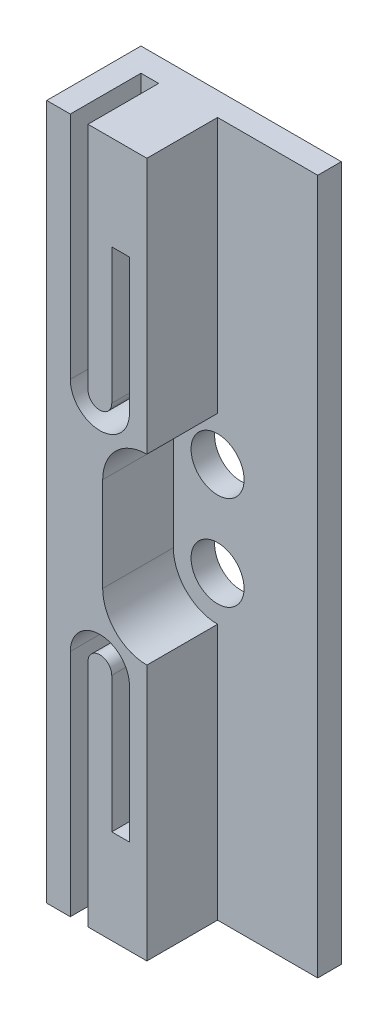
from build123d import *

# Parameters (mm, degrees)
ESQUISSE1_W             = 17
ESQUISSE1_H             = 59
BOSS_EXTRU_1_DEPTH      = 2
ESQUISSE2_W             = 8.5
ESQUISSE2_H             = 59
BOSS_EXTRU_2_DEPTH      = 6
ESQUISSE3_W             = 1.5
ESQUISSE3_H             = 19.5
ESQUISSE3_H_2           = 11.5
ENL_V_MAT_EXTRU_1_DEPTH = 6
ESQUISSE4_R             = 2.25
ENL_V_MAT_EXTRU_2_DEPTH = 14
ENL_V_MAT_EXTRU_3_DEPTH = 6


with BuildPart() as part:
    # Esquisse1 → Boss.-Extru.1 (new body)
    with BuildSketch(Plane.XY):
        with Locations((8.5, -29.5)):
            Rectangle(ESQUISSE1_W, ESQUISSE1_H)
    extrude(amount=BOSS_EXTRU_1_DEPTH)

    # Esquisse2 → Boss.-Extru.2 (add)
    with BuildSketch(Plane.XY.offset(2)):
        with Locations((4.25, -29.5)):
            Rectangle(ESQUISSE2_W, ESQUISSE2_H)
    extrude(amount=BOSS_EXTRU_2_DEPTH)

    # Esquisse3 → Enlèv. mat.-Extru.1 (cut)
    with BuildSketch(Plane.XY.offset(8)):
        with Locations((2.75, -49.25)):
            Rectangle(ESQUISSE3_W, ESQUISSE3_H)
        with BuildLine():
            ThreePointArc((3.5, -37.202199257), (2.408191843, -38.127967907), (2, -39.5))
            Line((2, -39.5), (3.5, -39.5))
            Line((3.5, -39.5), (3.5, -37.202199257))
        make_face()
        with BuildLine():
            Line((3.5, -37.202199257), (3.5, -39.5))
            ThreePointArc((3.5, -39.5), (4.509962751, -38.490037249), (5.519925502, -39.5))
            Line((5.519925502, -39.5), (5.519925502, -37.202199257))
            ThreePointArc((5.519925502, -37.202199257), (4.509962751, -36.990037249), (3.5, -37.202199257))
        make_face()
        with BuildLine():
            Line((5.519925502, -37.202199257), (5.519925502, -39.5))
            Line((5.519925502, -39.5), (7.019925502, -39.5))
            ThreePointArc((7.019925502, -39.5), (6.611733659, -38.127967907), (5.519925502, -37.202199257))
        make_face()
        with Locations((6.269925502, -45.25)):
            Rectangle(ESQUISSE3_W, ESQUISSE3_H_2)
        with Locations((6.269925502, -13.75)):
            Rectangle(ESQUISSE3_W, ESQUISSE3_H_2)
        with Locations((2.75, -9.75)):
            Rectangle(ESQUISSE3_W, ESQUISSE3_H)
        with BuildLine():
            Line((3.5, -19.5), (2, -19.5))
            ThreePointArc((2, -19.5), (2.408191843, -20.872032093), (3.5, -21.797800743))
            Line((3.5, -21.797800743), (3.5, -19.5))
        make_face()
        with BuildLine():
            ThreePointArc((5.519925502, -19.5), (4.509962751, -20.509962751), (3.5, -19.5))
            Line((3.5, -19.5), (3.5, -21.797800743))
            ThreePointArc((3.5, -21.797800743), (4.509962751, -22.009962751), (5.519925502, -21.797800743))
            Line((5.519925502, -21.797800743), (5.519925502, -19.5))
        make_face()
        with BuildLine():
            Line((7.019925502, -19.5), (5.519925502, -19.5))
            Line((5.519925502, -19.5), (5.519925502, -21.797800743))
            ThreePointArc((5.519925502, -21.797800743), (6.611733659, -20.872032093), (7.019925502, -19.5))
        make_face()
    extrude(amount=-ENL_V_MAT_EXTRU_1_DEPTH, mode=Mode.SUBTRACT)

    # Esquisse4 → Enlèv. mat.-Extru.2 (cut)
    with BuildSketch(Plane.XY.offset(8)):
        with Locations((8.5, -33.5)):
            Circle(ESQUISSE4_R)
        with Locations((8.5, -25.5)):
            Circle(ESQUISSE4_R)
    extrude(amount=-ENL_V_MAT_EXTRU_2_DEPTH, mode=Mode.SUBTRACT)

    # Esquisse5 → Enlèv. mat.-Extru.3 (cut)
    with BuildSketch(Plane.XY.offset(8)):
        with BuildLine():
            Line((4.75, -25.5), (4.75, -33.5))
            ThreePointArc((4.75, -33.5), (5.848349571, -30.848349571), (8.5, -29.75))
            Line((8.5, -29.75), (8.5, -29.25))
            ThreePointArc((8.5, -29.25), (5.848349571, -28.151650429), (4.75, -25.5))
        make_face()
        with BuildLine():
            ThreePointArc((8.5, -21.75), (5.848349571, -22.848349571), (4.75, -25.5))
            ThreePointArc((4.75, -25.5), (5.848349571, -28.151650429), (8.5, -29.25))
            Line((8.5, -29.25), (8.5, -27.75))
            ThreePointArc((8.5, -27.75), (6.25, -25.5), (8.5, -23.25))
            Line((8.5, -23.25), (8.5, -21.75))
        make_face()
        with BuildLine():
            ThreePointArc((12.25, -25.5), (11.151650429, -22.848349571), (8.5, -21.75))
            Line((8.5, -21.75), (8.5, -23.25))
            ThreePointArc((8.5, -23.25), (6.25, -25.5), (8.5, -27.75))
            Line((8.5, -27.75), (8.5, -29.25))
            ThreePointArc((8.5, -29.25), (11.151650429, -28.151650429), (12.25, -25.5))
        make_face()
        with BuildLine():
            ThreePointArc((8.5, -29.75), (5.848349571, -30.848349571), (4.75, -33.5))
            ThreePointArc((4.75, -33.5), (5.848349571, -36.151650429), (8.5, -37.25))
            Line((8.5, -37.25), (8.5, -35.75))
            ThreePointArc((8.5, -35.75), (6.25, -33.5), (8.5, -31.25))
            Line((8.5, -31.25), (8.5, -29.75))
        make_face()
        with BuildLine():
            ThreePointArc((12.25, -33.5), (11.151650429, -30.848349571), (8.5, -29.75))
            Line((8.5, -29.75), (8.5, -31.25))
            ThreePointArc((8.5, -31.25), (6.25, -33.5), (8.5, -35.75))
            Line((8.5, -35.75), (8.5, -37.25))
            ThreePointArc((8.5, -37.25), (11.151650429, -36.151650429), (12.25, -33.5))
        make_face()
    extrude(amount=-ENL_V_MAT_EXTRU_3_DEPTH, mode=Mode.SUBTRACT)


solid = part.part
